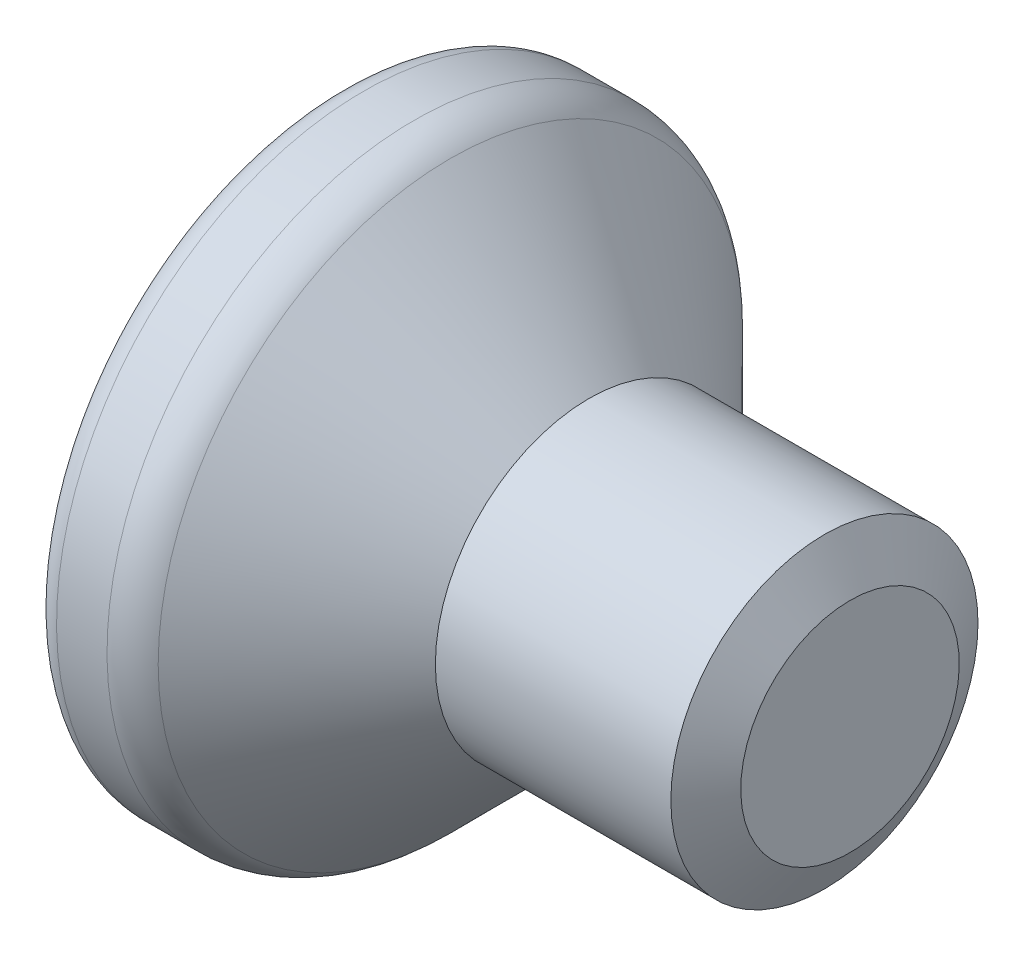
from build123d import *

# Parameters (mm, degrees)
FILLET_1_R          = 0.5
FILLET_2_R          = 1
CUT_EXTRUDE_1_DEPTH = 2.5
CHAMFER_1_SIZE      = 0.5
CHAMFER_1_SIZE2     = 0.866025404


with BuildPart() as part:
    # 草图1 → 旋转1 (revolve)
    with BuildSketch(Plane.XY):
        Polygon((5, 0), (-5, 0), (-5, 6), (-3.1, 6), (-0.1, 3), (5, 3), align=None)
    revolve(axis=Axis((5, 0, 0), (-1, 0, 0)))

    # 圆角1
    fillet_1_edges = [part.edges().sort_by_distance(p)[0] for p in [
        (-5, -6, 0),
    ]]
    fillet(fillet_1_edges, radius=FILLET_1_R)

    # 圆角2
    fillet_2_edges = [part.edges().sort_by_distance(p)[0] for p in [
        (-3.1, -6, 0),
    ]]
    fillet(fillet_2_edges, radius=FILLET_2_R)

    # 草图2 → 切除-拉伸1 (cut)
    with BuildSketch(Plane.ZY.offset(5)):
        Polygon((0, 2.309401077), (-2, 1.154700538), (-2, -1.154700538), (0, -2.309401077), (2, -1.154700538), (2, 1.154700538), align=None)
    extrude(amount=-CUT_EXTRUDE_1_DEPTH, mode=Mode.SUBTRACT)

    # 倒角1
    chamfer_1_edges = [part.edges().sort_by_distance(p)[0] for p in [
        (5, -3, 0),
    ]]
    chamfer_1_side = [part.faces().sort_by_distance(p)[0] for p in [
        (2.45, -3, 0),
    ]]
    chamfer(chamfer_1_edges, length=CHAMFER_1_SIZE, length2=CHAMFER_1_SIZE2, reference=chamfer_1_side[0])


solid = part.part
